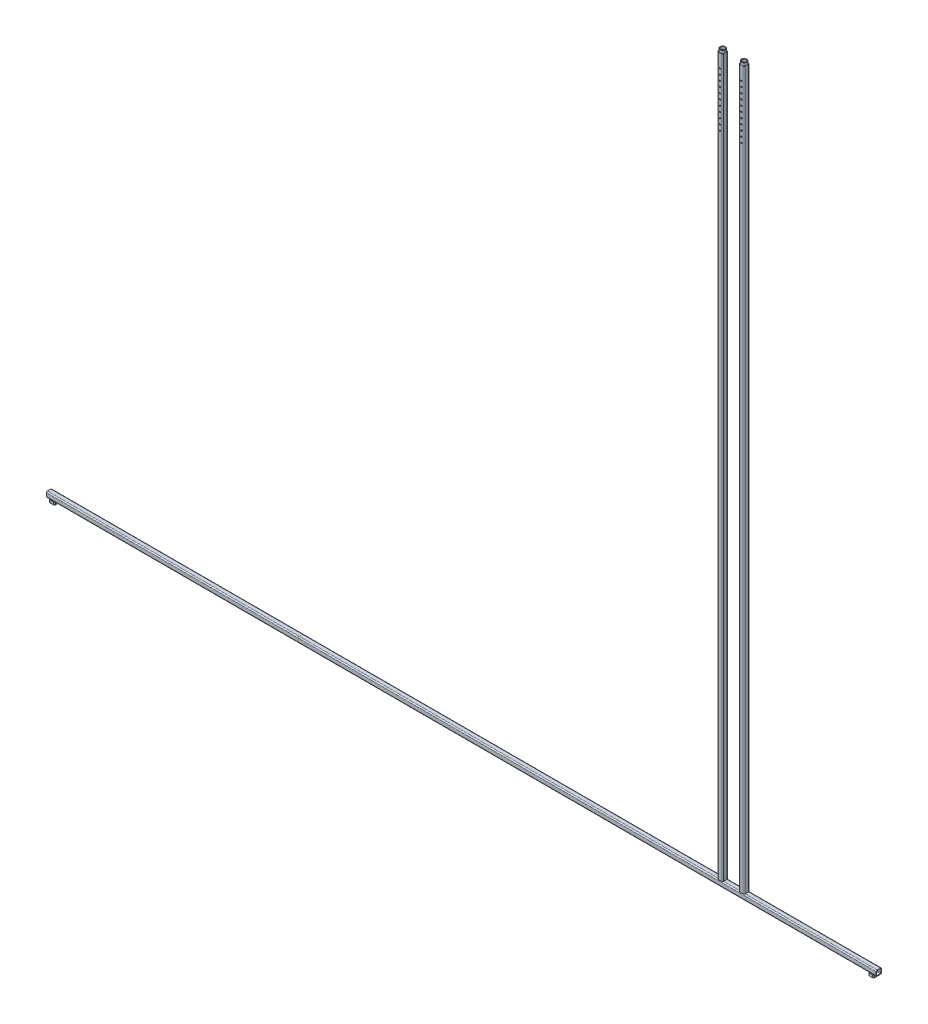
from build123d import *

# Parameters (mm, degrees)
SQUARE_TUBE_20_X_20_X_2_1_DEPTH   = 2660
SQUARE_TUBE_20_X_20_X_2_1_2_DEPTH = 2660
SQUARE_TUBE_20_X_20_X_2_2_DEPTH   = 2146
SQUARE_TUBE_20_X_20_X_2_2_2_DEPTH = 934
SQUARE_TUBE_20_X_20_X_2_4_DEPTH   = 10
SQUARE_TUBE_20_X_20_X_2_4_2_DEPTH = 10
SKETCH14_R                        = 2.5
CUT_EXTRUDE1_DEPTH                = 2970.606517495
LPATTERN1_COUNT                   = 11
LPATTERN1_PITCH                   = 20
SKETCH15_R                        = 2.5
CUT_EXTRUDE2_DEPTH                = 2970.606517495
LPATTERN2_COUNT                   = 11
LPATTERN2_PITCH                   = 20
SKETCH16_R                        = 10
SKETCH16_R_2                      = 8
BOSS_EXTRUDE1_DEPTH               = 10
SKETCH18_R                        = 9.941903213
SKETCH18_R_2                      = 8.015816656
BOSS_EXTRUDE2_DEPTH               = 10


with BuildPart() as part:
    # Sketch1 → Square tube 20 X 20 X 2(1) (new body)
    with BuildSketch(Plane(origin=(385.446107784, 689.476047904, 0), x_dir=(1, 0, 0), z_dir=(0, -1, 0))):
        with BuildLine():
            Line((-6, -10), (6, -10))
            ThreePointArc((6, -10), (8.828427125, -8.828427125), (10, -6))
            Line((10, -6), (10, 6))
            ThreePointArc((10, 6), (8.828427125, 8.828427125), (6, 10))
            Line((6, 10), (-6, 10))
            ThreePointArc((-6, 10), (-8.828427125, 8.828427125), (-10, 6))
            Line((-10, 6), (-10, -6))
            ThreePointArc((-10, -6), (-8.828427125, -8.828427125), (-6, -10))
        make_face()
        with BuildLine():
            Line((-6, -8), (6, -8))
            ThreePointArc((6, -8), (7.414213562, -7.414213562), (8, -6))
            Line((8, -6), (8, 6))
            ThreePointArc((8, 6), (7.414213562, 7.414213562), (6, 8))
            Line((6, 8), (-6, 8))
            ThreePointArc((-6, 8), (-7.414213562, 7.414213562), (-8, 6))
            Line((-8, 6), (-8, -6))
            ThreePointArc((-8, -6), (-7.414213562, -7.414213562), (-6, -8))
        make_face(mode=Mode.SUBTRACT)
    extrude(amount=SQUARE_TUBE_20_X_20_X_2_1_DEPTH)

    # Sketch14 → Cut-Extrude1 (cut, symmetric)
    with BuildSketch(Plane(origin=(0, 0, -10), x_dir=(-1, 0, 0), z_dir=(0, 0, -1))):
        with Locations(Location((-384.847064026, 639.476047904, 0), (0, 0, 180))):
            Circle(SKETCH14_R)
    cut_extrude1 = extrude(amount=CUT_EXTRUDE1_DEPTH, both=True, mode=Mode.SUBTRACT)

    # LPattern1: Cut-Extrude1 ×11
    with Locations(*[(0, -i * LPATTERN1_PITCH, 0) for i in range(1, LPATTERN1_COUNT)]):
        add(cut_extrude1, mode=Mode.SUBTRACT)


with BuildPart() as body_2:
    # Sketch1 on segment 2 (carried to segment 2) → Square tube 20 X 20 X 2_1 2 (new body)
    with BuildSketch(Plane(origin=(305.446107784, 689.476047904, 0), x_dir=(1, 0, 0), z_dir=(0, -1, 0))):
        with BuildLine():
            Line((-6, -10), (6, -10))
            ThreePointArc((6, -10), (8.828427125, -8.828427125), (10, -6))
            Line((10, -6), (10, 6))
            ThreePointArc((10, 6), (8.828427125, 8.828427125), (6, 10))
            Line((6, 10), (-6, 10))
            ThreePointArc((-6, 10), (-8.828427125, 8.828427125), (-10, 6))
            Line((-10, 6), (-10, -6))
            ThreePointArc((-10, -6), (-8.828427125, -8.828427125), (-6, -10))
        make_face()
        with BuildLine():
            Line((-6, -8), (6, -8))
            ThreePointArc((6, -8), (7.414213562, -7.414213562), (8, -6))
            Line((8, -6), (8, 6))
            ThreePointArc((8, 6), (7.414213562, 7.414213562), (6, 8))
            Line((6, 8), (-6, 8))
            ThreePointArc((-6, 8), (-7.414213562, 7.414213562), (-8, 6))
            Line((-8, 6), (-8, -6))
            ThreePointArc((-8, -6), (-7.414213562, -7.414213562), (-6, -8))
        make_face(mode=Mode.SUBTRACT)
    extrude(amount=SQUARE_TUBE_20_X_20_X_2_1_2_DEPTH)

    # Sketch15 → Cut-Extrude2 (cut, symmetric)
    with BuildSketch(Plane(origin=(0, 0, -10), x_dir=(-1, 0, 0), z_dir=(0, 0, -1))):
        with Locations(Location((-305.446107784, 639.476047904, 0), (0, 0, 180))):
            Circle(SKETCH15_R)
    cut_extrude2 = extrude(amount=CUT_EXTRUDE2_DEPTH, both=True, mode=Mode.SUBTRACT)

    # LPattern2: Cut-Extrude2 ×11
    with Locations(*[(0, -i * LPATTERN2_PITCH, 0) for i in range(1, LPATTERN2_COUNT)]):
        add(cut_extrude2, mode=Mode.SUBTRACT)


with BuildPart() as body_3:
    # Sketch11 → Square tube 20 X 20 X 2(2) (new body)
    with BuildSketch(Plane(origin=(-1260.553892216, -1980.523952096, 0), x_dir=(0, -1, 0), z_dir=(-1, 0, 0))):
        with BuildLine():
            Line((-6, -10), (6, -10))
            ThreePointArc((6, -10), (8.828427125, -8.828427125), (10, -6))
            Line((10, -6), (10, 6))
            ThreePointArc((10, 6), (8.828427125, 8.828427125), (6, 10))
            Line((6, 10), (-6, 10))
            ThreePointArc((-6, 10), (-8.828427125, 8.828427125), (-10, 6))
            Line((-10, 6), (-10, -6))
            ThreePointArc((-10, -6), (-8.828427125, -8.828427125), (-6, -10))
        make_face()
        with BuildLine():
            Line((-6, -8), (6, -8))
            ThreePointArc((6, -8), (7.414213562, -7.414213562), (8, -6))
            Line((8, -6), (8, 6))
            ThreePointArc((8, 6), (7.414213562, 7.414213562), (6, 8))
            Line((6, 8), (-6, 8))
            ThreePointArc((-6, 8), (-7.414213562, 7.414213562), (-8, 6))
            Line((-8, 6), (-8, -6))
            ThreePointArc((-8, -6), (-7.414213562, -7.414213562), (-6, -8))
        make_face(mode=Mode.SUBTRACT)
    extrude(amount=-SQUARE_TUBE_20_X_20_X_2_2_DEPTH)


with BuildPart() as body_4:
    # Sketch11 on segment 2 (carried to segment 2) → Square tube 20 X 20 X 2_2 2 (new body)
    with BuildSketch(Plane(origin=(-1260.553892216, -1980.523952096, 0), x_dir=(0, -1, 0), z_dir=(-1, 0, 0))):
        with BuildLine():
            Line((-6, -10), (6, -10))
            ThreePointArc((6, -10), (8.828427125, -8.828427125), (10, -6))
            Line((10, -6), (10, 6))
            ThreePointArc((10, 6), (8.828427125, 8.828427125), (6, 10))
            Line((6, 10), (-6, 10))
            ThreePointArc((-6, 10), (-8.828427125, 8.828427125), (-10, 6))
            Line((-10, 6), (-10, -6))
            ThreePointArc((-10, -6), (-8.828427125, -8.828427125), (-6, -10))
        make_face()
        with BuildLine():
            Line((-6, -8), (6, -8))
            ThreePointArc((6, -8), (7.414213562, -7.414213562), (8, -6))
            Line((8, -6), (8, 6))
            ThreePointArc((8, 6), (7.414213562, 7.414213562), (6, 8))
            Line((6, 8), (-6, 8))
            ThreePointArc((-6, 8), (-7.414213562, 7.414213562), (-8, 6))
            Line((-8, 6), (-8, -6))
            ThreePointArc((-8, -6), (-7.414213562, -7.414213562), (-6, -8))
        make_face(mode=Mode.SUBTRACT)
    extrude(amount=SQUARE_TUBE_20_X_20_X_2_2_2_DEPTH)


with BuildPart() as body_5:
    # Sketch13 → Square tube 20 X 20 X 2(4) (new body)
    with BuildSketch(Plane(origin=(-2174.553892216, -1990.523952096, 0), x_dir=(1, 0, 0), z_dir=(0, -1, 0))):
        with BuildLine():
            Line((-6, -10), (6, -10))
            ThreePointArc((6, -10), (8.828427125, -8.828427125), (10, -6))
            Line((10, -6), (10, 6))
            ThreePointArc((10, 6), (8.828427125, 8.828427125), (6, 10))
            Line((6, 10), (-6, 10))
            ThreePointArc((-6, 10), (-8.828427125, 8.828427125), (-10, 6))
            Line((-10, 6), (-10, -6))
            ThreePointArc((-10, -6), (-8.828427125, -8.828427125), (-6, -10))
        make_face()
        with BuildLine():
            Line((-6, -8), (6, -8))
            ThreePointArc((6, -8), (7.414213562, -7.414213562), (8, -6))
            Line((8, -6), (8, 6))
            ThreePointArc((8, 6), (7.414213562, 7.414213562), (6, 8))
            Line((6, 8), (-6, 8))
            ThreePointArc((-6, 8), (-7.414213562, 7.414213562), (-8, 6))
            Line((-8, 6), (-8, -6))
            ThreePointArc((-8, -6), (-7.414213562, -7.414213562), (-6, -8))
        make_face(mode=Mode.SUBTRACT)
    extrude(amount=SQUARE_TUBE_20_X_20_X_2_4_DEPTH)


with BuildPart() as body_6:
    # Sketch13 on segment 2 (carried to segment 2) → Square tube 20 X 20 X 2_4 2 (new body)
    with BuildSketch(Plane(origin=(865.446107784, -1990.523952096, 0), x_dir=(1, 0, 0), z_dir=(0, -1, 0))):
        with BuildLine():
            Line((-6, -10), (6, -10))
            ThreePointArc((6, -10), (8.828427125, -8.828427125), (10, -6))
            Line((10, -6), (10, 6))
            ThreePointArc((10, 6), (8.828427125, 8.828427125), (6, 10))
            Line((6, 10), (-6, 10))
            ThreePointArc((-6, 10), (-8.828427125, 8.828427125), (-10, 6))
            Line((-10, 6), (-10, -6))
            ThreePointArc((-10, -6), (-8.828427125, -8.828427125), (-6, -10))
        make_face()
        with BuildLine():
            Line((-6, -8), (6, -8))
            ThreePointArc((6, -8), (7.414213562, -7.414213562), (8, -6))
            Line((8, -6), (8, 6))
            ThreePointArc((8, 6), (7.414213562, 7.414213562), (6, 8))
            Line((6, 8), (-6, 8))
            ThreePointArc((-6, 8), (-7.414213562, 7.414213562), (-8, 6))
            Line((-8, 6), (-8, -6))
            ThreePointArc((-8, -6), (-7.414213562, -7.414213562), (-6, -8))
        make_face(mode=Mode.SUBTRACT)
    extrude(amount=SQUARE_TUBE_20_X_20_X_2_4_2_DEPTH)


with BuildPart() as body_7:
    # Sketch16 → Boss-Extrude1 (new body)
    with BuildSketch(Plane(origin=(0, 689.476047904, 0), x_dir=(1, 0, 0), z_dir=(0, 1, 0))):
        with Locations(Location((385.446107784, 0, 0), (0, 0, 180))):
            Circle(SKETCH16_R)
        with Locations(Location((385.446107784, 0, 0), (0, 0, 180))):
            Circle(SKETCH16_R_2, mode=Mode.SUBTRACT)
    extrude(amount=BOSS_EXTRUDE1_DEPTH)


with BuildPart() as body_8:
    # Sketch18 → Boss-Extrude2 (new body)
    with BuildSketch(Plane(origin=(0, 689.476047904, 0), x_dir=(1, 0, 0), z_dir=(0, 1, 0))):
        with Locations(Location((305.387800045, 0.015816656, 0), (0, 0, 180))):
            Circle(SKETCH18_R)
        with Locations(Location((305.387800045, 0.015816656, 0), (0, 0, 180))):
            Circle(SKETCH18_R_2, mode=Mode.SUBTRACT)
    extrude(amount=BOSS_EXTRUDE2_DEPTH)


solid = Compound([part.part, body_2.part, body_3.part, body_4.part, body_5.part, body_6.part, body_7.part, body_8.part])
